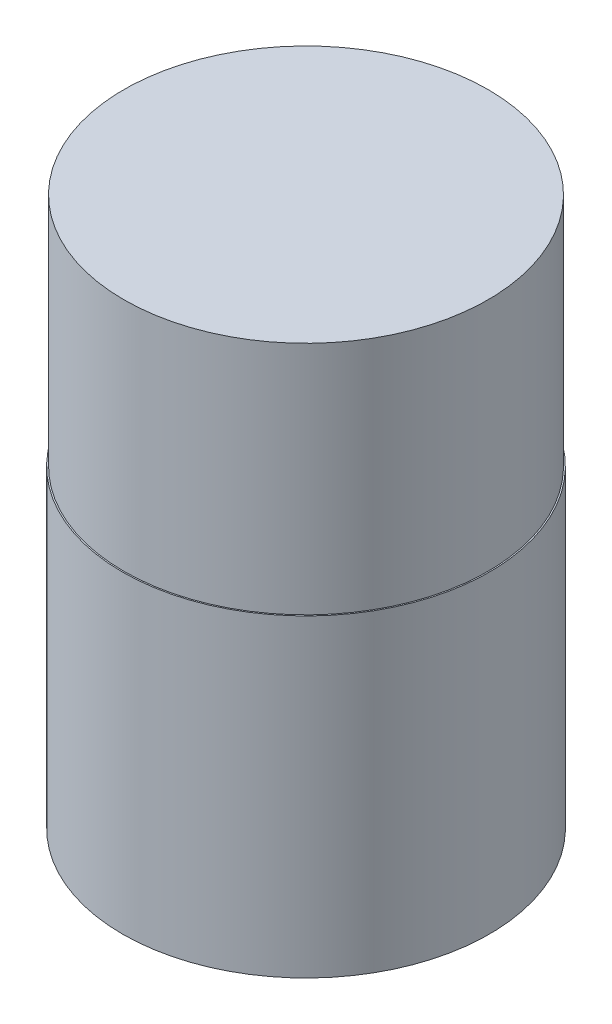
from build123d import *

# Parameters (mm, degrees)
SKETCH1_R           = 5.9436
BOSS_EXTRUDE1_DEPTH = 10.16
SKETCH2_R           = 5.9
BOSS_EXTRUDE2_DEPTH = 7.62


with BuildPart() as part:
    # Sketch1 → Boss-Extrude1 (new body)
    with BuildSketch(Plane(origin=(0, 0, 0), x_dir=(1, 0, 0), z_dir=(0, 1, 0))):
        with Locations(Location((0, 0, 0), (0, 0, 270))):
            Circle(SKETCH1_R)
    extrude(amount=BOSS_EXTRUDE1_DEPTH)

    # Sketch2 → Boss-Extrude2 (add)
    with BuildSketch(Plane(origin=(0, 10.16, 0), x_dir=(1, 0, 0), z_dir=(0, 1, 0))):
        with Locations(Location((0, 0, 0), (0, 0, 90))):
            Circle(SKETCH2_R)
    extrude(amount=BOSS_EXTRUDE2_DEPTH)


solid = part.part
